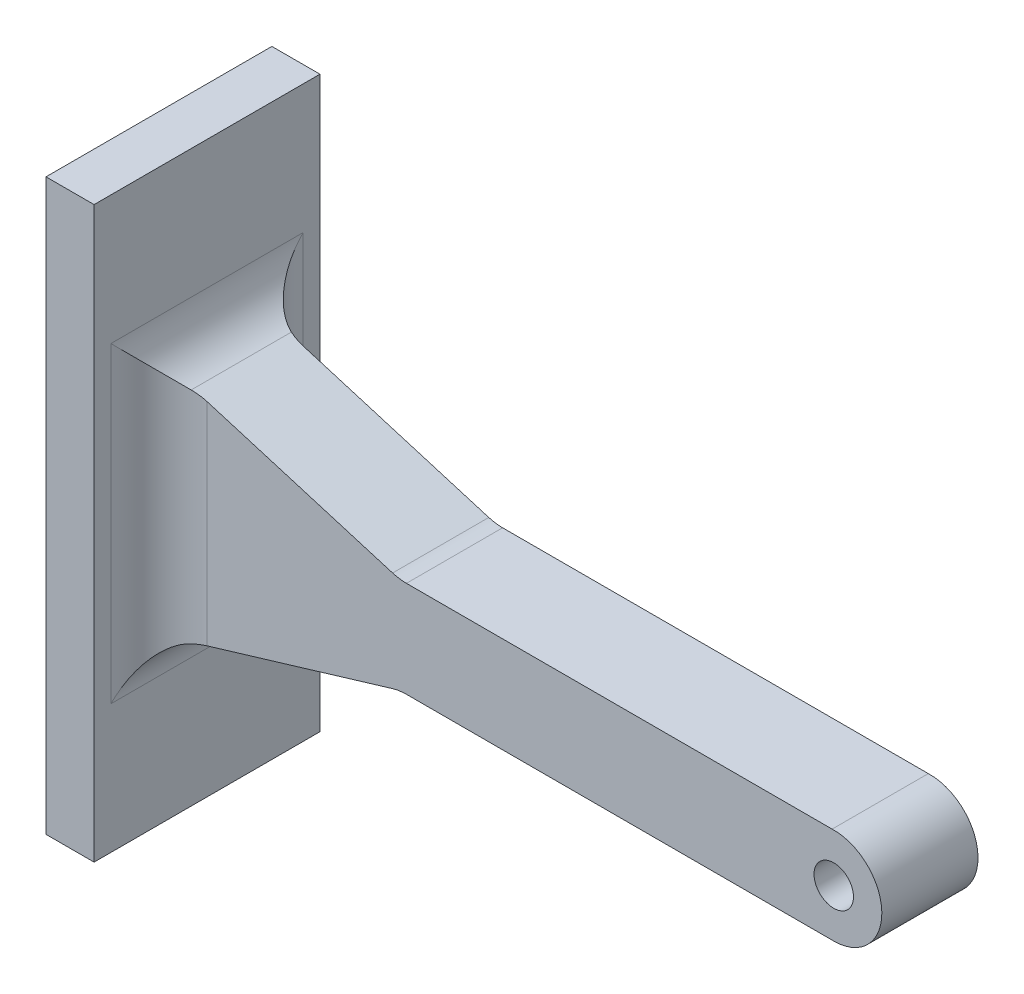
from build123d import *

# Parameters (mm, degrees)
SKETCH_1_R          = 2.05
EXTRUDE_1_DEPTH     = 5
SKETCH_3_W          = 23.485848614
SKETCH_3_H          = 59.214320442
EXTRUDE_2_DEPTH     = 5
CUT_EXTRUDE_1_DEPTH = 4
FILLET_1_R          = 5


with BuildPart() as part:
    # 草圖1 → 填料-伸長1 (new, symmetric)
    with BuildSketch(Plane.XY):
        with BuildLine():
            Line((-30.167793166, 4.997183752), (14.832206834, 4.997183752))
            ThreePointArc((14.832206834, 4.997183752), (19.999295888, 0.083908399), (15, -5))
            Line((15, -5), (-30.167793166, -4.997183752))
            Line((-30.167793166, -4.997183752), (-55.167793166, -12.5))
            Line((-55.167793166, -12.5), (-55.167793166, 12.5))
            Line((-55.167793166, 12.5), (-30.167793166, 4.997183752))
        make_face()
        with Locations((15, 0)):
            Circle(SKETCH_1_R, mode=Mode.SUBTRACT)
    extrude(amount=EXTRUDE_1_DEPTH, both=True)

    # 草圖3 → 填料-伸長2 (add)
    with BuildSketch(Plane.ZY.offset(55.167793166)):
        Rectangle(SKETCH_3_W, SKETCH_3_H)
    extrude(amount=EXTRUDE_2_DEPTH)

    # 草圖4 → 除料-伸長1 (cut)
    with BuildSketch(Plane(origin=(0, 0, -5), x_dir=(-1, 0, 0), z_dir=(0, 0, -1))):
        Polygon((-16.638696654, -2.675834113), (-13.416200442, -2.938229795), (-11.57771101, -0.278664052), (-12.96171779, 2.643297373), (-16.184214003, 2.905693054), (-18.022703435, 0.246127311), align=None)
    extrude(amount=-CUT_EXTRUDE_1_DEPTH, mode=Mode.SUBTRACT)

    # 圓角1
    fillet_1_edges = [part.edges().sort_by_distance(p)[0] for p in [
        (-30.167793166, 4.997183752, 0),
        (-30.167793166, -4.997183752, 0),
        (-55.167793166, -12.5, 0),
        (-55.167793166, 12.5, 0),
        (-55.167793166, 0, -5),
        (-55.167793166, 0, 5),
    ]]
    fillet(fillet_1_edges, radius=FILLET_1_R)


solid = part.part
